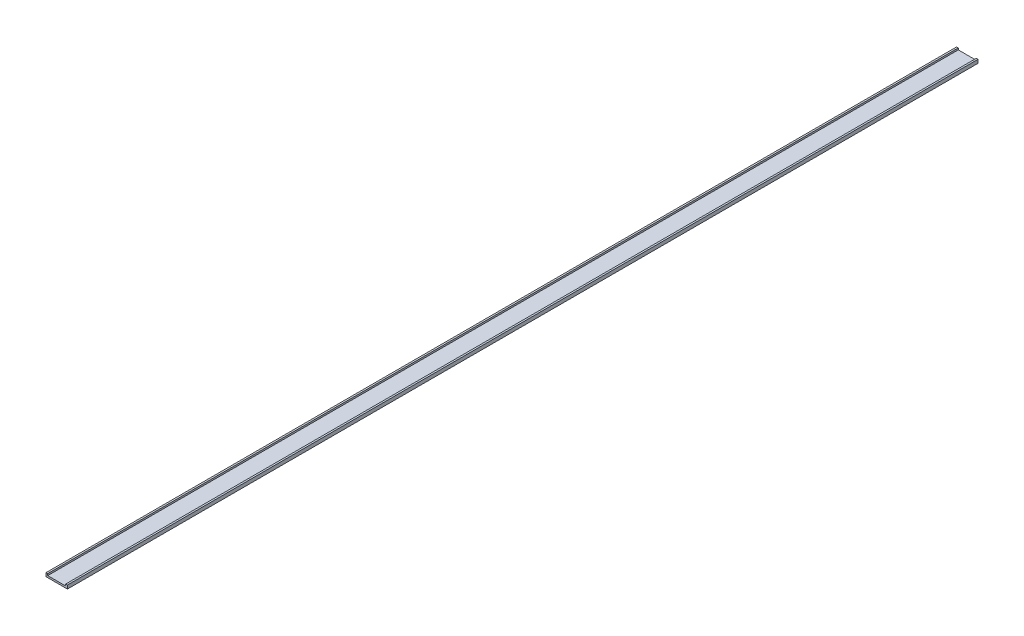
from build123d import *

# Parameters (mm, degrees)
EXTRUDE_1_DEPTH = 1700


with BuildPart() as part:
    # 草图1 → 凸台-拉伸1 (new body)
    with BuildSketch(Plane.XY):
        Polygon((20, 0), (-20, 0), (-20, 6.6), (-16.8, 6.6), (-16.8, 3.4), (16.8, 3.4), (16.8, 6.6), (20, 6.6), align=None)
    extrude(amount=EXTRUDE_1_DEPTH)


solid = part.part
